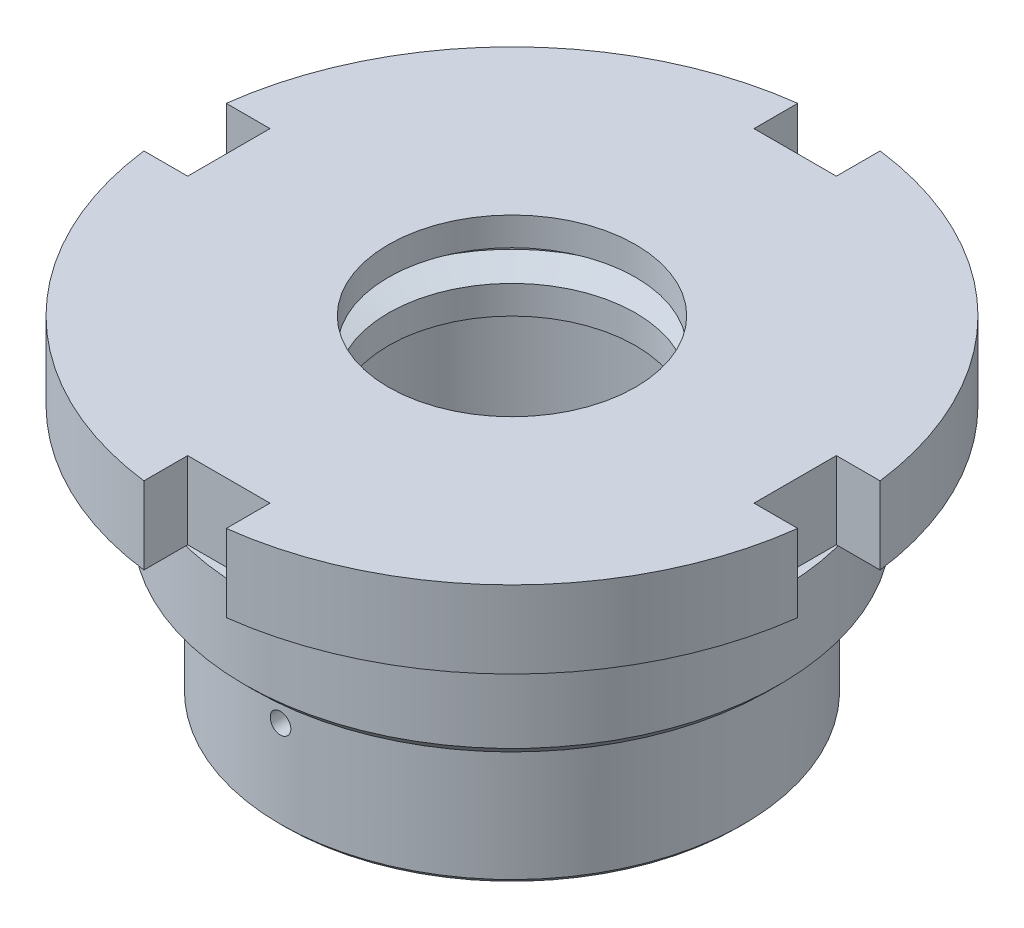
from build123d import *

# Parameters (mm, degrees)
SKETCH_1_W                = 64
SKETCH_1_H                = 15
CUT_EXTRUDE_1_DEPTH       = 92.744209627
CUT_EXTRUDE_2_DEPTH       = 92.744209627
CUT_EXTRUDE_3_DEPTH       = 92.744209627
CUT_EXTRUDE_4_DEPTH       = 92.394748208
HOLE_WIZARD_4_0_4_1_D     = 4
HOLE_WIZARD_4_0_4_1_DEPTH = 27.553629954
HOLE_WIZARD_4_0_4_2_D     = 4
HOLE_WIZARD_4_0_4_2_DEPTH = 108.498031466
CHAMFER_1_SIZE            = 2
CHAMFER_2_SIZE            = 1


with BuildPart() as part:
    # Эскиз1 → Повернуть1 (revolve)
    with BuildSketch(Plane(origin=(0, 0, 0), x_dir=(-1, 0, 0), z_dir=(0, 0, -1)), mode=Mode.PRIVATE) as revolve_1_sk:
        with Locations((-32, 56.5)):
            Rectangle(SKETCH_1_W, SKETCH_1_H)
    revolve(revolve_1_sk.sketch.rotate(Axis((0, 49, 0), (0, 1, 0)), 270), axis=Axis((0, 49, 0), (0, 1, 0)))

    # Эскиз2 → Вырез-Вытянуть1 (cut, through all)
    with BuildSketch(Plane(origin=(0, 64, 0), x_dir=(-1, 0, 0), z_dir=(0, 1, 0))):
        with BuildLine():
            Line((63.498031466, 8), (55, 8))
            Line((55, 8), (55, -8))
            Line((55, -8), (63.498031466, -8))
            ThreePointArc((63.498031466, -8), (64, 0), (63.498031466, 8))
        make_face()
    extrude(amount=-CUT_EXTRUDE_1_DEPTH, mode=Mode.SUBTRACT)

    # Эскиз3 → Вырез-Вытянуть2 (cut, through all)
    with BuildSketch(Plane(origin=(0, 64, 0), x_dir=(-1, 0, 0), z_dir=(0, 1, 0))):
        with BuildLine():
            Line((8, -63.498031466), (8, -55))
            Line((8, -55), (-8, -55))
            Line((-8, -55), (-8, -63.498031466))
            ThreePointArc((-8, -63.498031466), (0, -64), (8, -63.498031466))
        make_face()
    extrude(amount=-CUT_EXTRUDE_2_DEPTH, mode=Mode.SUBTRACT)

    # Эскиз4 → Вырез-Вытянуть3 (cut, through all)
    with BuildSketch(Plane(origin=(0, 64, 0), x_dir=(-1, 0, 0), z_dir=(0, 1, 0))):
        with BuildLine():
            Line((-63.498031466, -8), (-55, -8))
            Line((-55, -8), (-55, 8))
            Line((-55, 8), (-63.498031466, 8))
            ThreePointArc((-63.498031466, 8), (-64, 0), (-63.498031466, -8))
        make_face()
    extrude(amount=-CUT_EXTRUDE_3_DEPTH, mode=Mode.SUBTRACT)

    # Эскиз5 → Вырез-Вытянуть4 (cut, through all)
    with BuildSketch(Plane(origin=(0, 64, 0), x_dir=(-1, 0, 0), z_dir=(0, 1, 0))):
        with BuildLine():
            Line((-8, 63.498031466), (-8, 55))
            Line((-8, 55), (8, 55))
            Line((8, 55), (8, 63.498031466))
            ThreePointArc((8, 63.498031466), (0, 64), (-8, 63.498031466))
        make_face()
    extrude(amount=-CUT_EXTRUDE_4_DEPTH, mode=Mode.SUBTRACT)

    # Эскиз6 → Повернуть2 (revolve)
    with BuildSketch(Plane(origin=(0, 0, 0), x_dir=(-1, 0, 0), z_dir=(0, 0, -1)), mode=Mode.PRIVATE) as revolve_2_sk:
        Polygon((-45, 0), (0, 0), (0, 49), (-48, 49), (-48, 44), (-52, 44), (-52, 26), (-45, 26), align=None)
    revolve(revolve_2_sk.sketch.rotate(Axis((0, 0, 0), (0, 1, 0)), 270), axis=Axis((0, 0, 0), (0, 1, 0)))

    # Эскиз7 → Вырез-Повернуть1 (revolve, cut)
    with BuildSketch(Plane(origin=(0, 0, 0), x_dir=(-1, 0, 0), z_dir=(0, 0, -1)), mode=Mode.PRIVATE) as cut_revolve_1_sk:
        Polygon((-36, 0), (0, 0), (0, 64), (-24, 64), (-24, 58.5), (-30, 57.5), (-30, 54), (-24, 52.5), (-24, 47), (-36, 47), align=None)
    revolve(cut_revolve_1_sk.sketch.rotate(Axis((0, 0, 0), (0, 1, 0)), 270), axis=Axis((0, 0, 0), (0, 1, 0)), mode=Mode.SUBTRACT)

    # Диаметр отверстия Ø4.0 (4)1
    with Locations(Plane.XY.offset(-35.944401511)):
        with Locations((0, 18)):
            Hole(HOLE_WIZARD_4_0_4_1_D / 2, depth=HOLE_WIZARD_4_0_4_1_DEPTH)

    # Диаметр отверстия Ø4.0 (4)2
    with Locations(Plane(origin=(0, 18, 45), x_dir=(1, 0, 0), z_dir=(0, 0, 1))):
        with Locations((0, 0)):
            Hole(HOLE_WIZARD_4_0_4_2_D / 2, depth=HOLE_WIZARD_4_0_4_2_DEPTH)

    # Фаска1
    chamfer_1_edges = [part.edges().sort_by_distance(p)[0] for p in [
        (0, 26, -52),
    ]]
    chamfer(chamfer_1_edges, length=CHAMFER_1_SIZE)

    # Фаска2
    chamfer_2_edges = [part.edges().sort_by_distance(p)[0] for p in [
        (0, 0, -45),
    ]]
    chamfer(chamfer_2_edges, length=CHAMFER_2_SIZE)


solid = part.part
